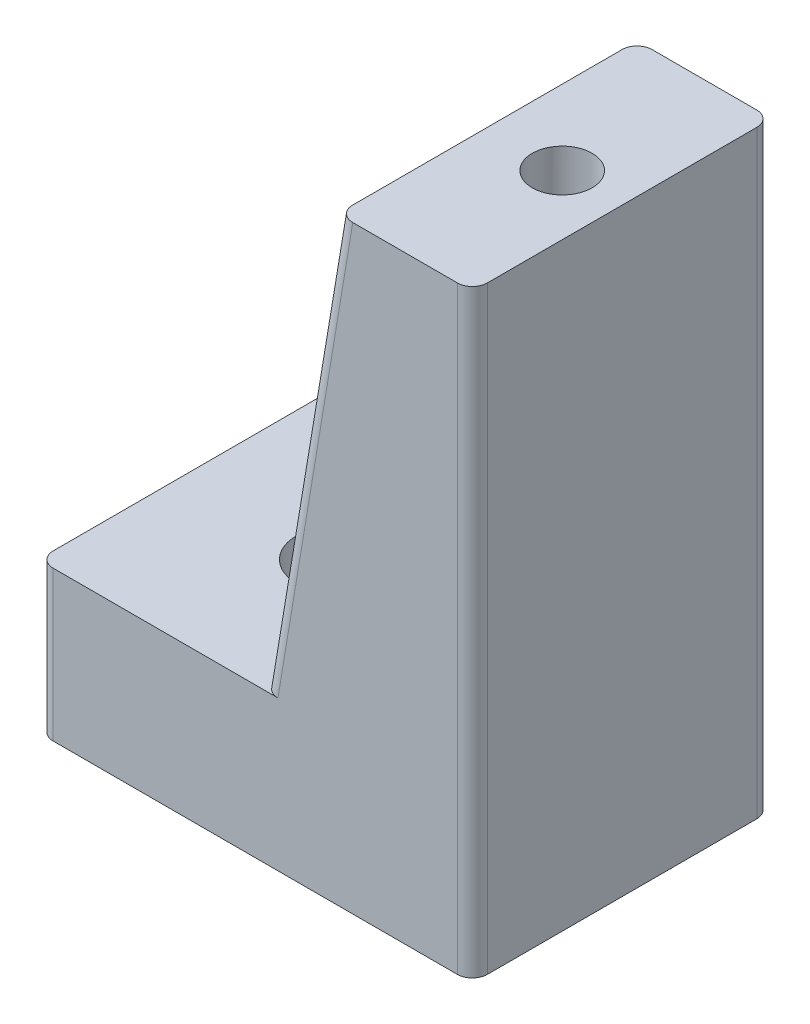
from build123d import *

# Parameters (mm, degrees)
EXTRUDE_1_DEPTH     = 20
SKETCH_2_R          = 2
SKETCH_2_R_2        = 2.75
CUT_EXTRUDE_1_DEPTH = 51.754310162
EXTRUDE_START       = -35
SKETCH_3_R          = 2
EXTRUDE_2_DEPTH     = 35
SKETCH_4_W          = 5
SKETCH_4_H          = 20
EXTRUDE_3_DEPTH     = 10
FILLET_2_R          = 1


with BuildPart() as part:
    # ｽｹｯﾁ1 → ﾎﾞｽ - 押し出し1 (new body)
    with BuildSketch(Plane.XY):
        Polygon((0, 0), (10, 0), (15, 30), (24, 30), (24, -10), (0, -10), align=None)
    extrude(amount=EXTRUDE_1_DEPTH)

    # ｽｹｯﾁ2 → ｶｯﾄ - 押し出し1 (cut, through all)
    with BuildSketch(Plane(origin=(0, 30, 0), x_dir=(1, 0, 0), z_dir=(0, 1, 0))):
        with Locations(Location((20, -10, 0), (0, 0, 270))):
            Circle(SKETCH_2_R)
        with Locations(Location((5, -10, 0), (0, 0, 270))):
            Circle(SKETCH_2_R_2)
    extrude(amount=-CUT_EXTRUDE_1_DEPTH, mode=Mode.SUBTRACT)

    # ｽｹｯﾁ3 → ﾎﾞｽ - 押し出し2 (add)
    with BuildSketch(Plane.XZ.offset(10).offset(EXTRUDE_START)):
        with Locations(Location((20, 10, 0), (0, 0, 90))):
            Circle(SKETCH_3_R)
    extrude(amount=EXTRUDE_2_DEPTH)

    # ｽｹｯﾁ4 → ﾎﾞｽ - 押し出し3 (add)
    with BuildSketch(Plane(origin=(0, 0, 0), x_dir=(1, 0, 0), z_dir=(0, 1, 0))):
        with Locations((-2.5, -10)):
            Rectangle(SKETCH_4_W, SKETCH_4_H)
    extrude(amount=-EXTRUDE_3_DEPTH)

    # ﾌｨﾚｯﾄ2
    fillet_2_edges = [part.edges().sort_by_distance(p)[0] for p in [
        (24, 10, 20),
        (12.5, 15, 20),
        (-5, -5, 20),
        (-5, -5, 0),
        (12.5, 15, 0),
        (24, 10, 0),
    ]]
    fillet(fillet_2_edges, radius=FILLET_2_R)


solid = part.part
